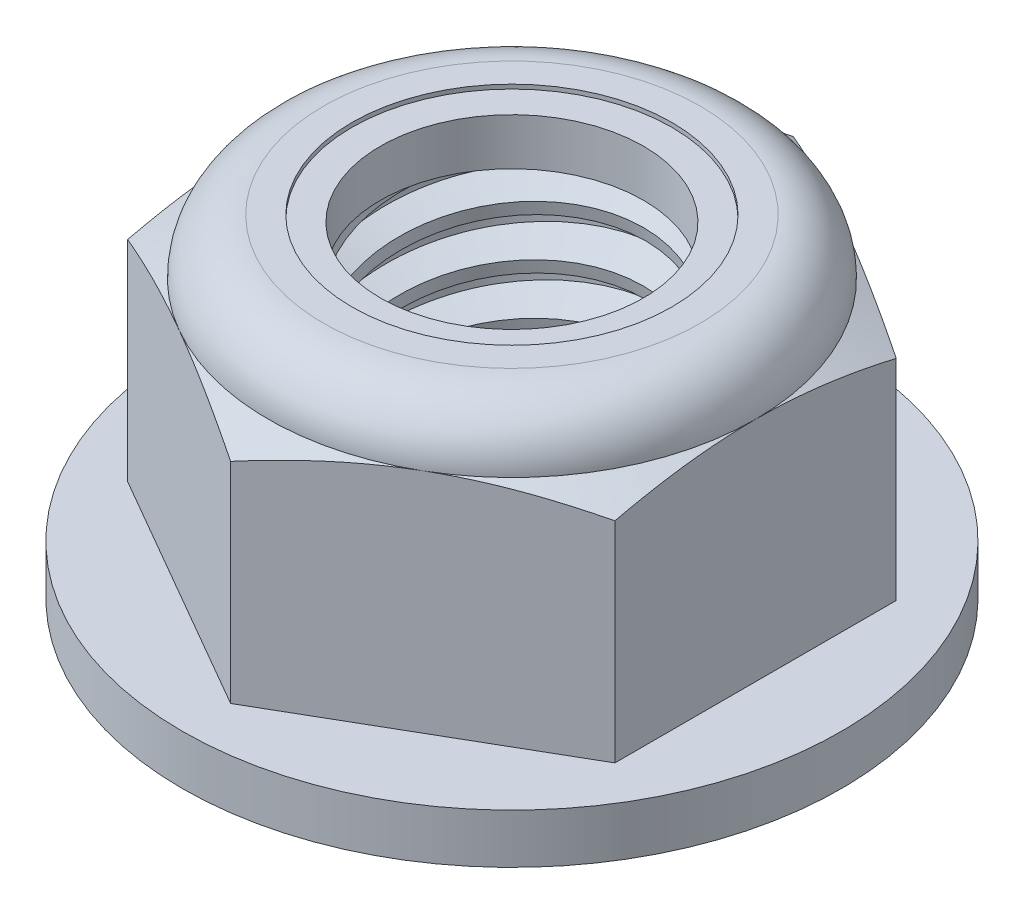
from build123d import *

# Parameters (mm, degrees)
EXTRUDE1_DEPTH       = 11.90625
SKETCH8_W            = 11.811
SKETCH8_H            = 1.778
SKETCH2_W            = 5.55625
SKETCH2_H            = 11.90625
LPATTERN1_COUNT      = 7
LPATTERN1_PITCH      = 1.814285714
LPATTERN1_COUNT_DIR2 = 2
LPATTERN1_PITCH_DIR2 = 1.814285714


with BuildPart() as part:
    # Sketch1 → Extrude1 (new body)
    with BuildSketch(Plane(origin=(0, 0, 0), x_dir=(1, 0, 0), z_dir=(0, 1, 0))):
        Polygon((0, 10.081979076), (-8.73125, 5.040989538), (-8.73125, -5.040989538), (0, -10.081979076), (8.73125, -5.040989538), (8.73125, 5.040989538), align=None)
    extrude(amount=EXTRUDE1_DEPTH)

    # Sketch8 → Revolve3 (revolve)
    with BuildSketch(Plane(origin=(0, 0, 0), x_dir=(0, 0, -1), z_dir=(1, 0, 0)), mode=Mode.PRIVATE) as revolve3_sk:
        with Locations((5.9055, 0.889)):
            Rectangle(SKETCH8_W, SKETCH8_H)
    revolve(revolve3_sk.sketch.rotate(Axis((0, 0, 0), (0, -1, 0)), 311.359571769), axis=Axis((0, 0, 0), (0, -1, 0)))

    # Sketch4 → Cut-Revolve2 (revolve, cut)
    with BuildSketch(Plane(origin=(0, 0, 0), x_dir=(0, 0, -1), z_dir=(1, 0, 0))):
        Polygon((0, 11.90625), (5.55625, 11.90625), (4.71496955, 11.513954483), (4.71496955, 0.392295517), (5.55625, 0), (0, 0), align=None)
    revolve(axis=Axis((0, 11.90625, 0), (0, 1, 0)), mode=Mode.SUBTRACT)


with BuildPart() as body_2:
    # Sketch2 → Revolve1 (revolve)
    with BuildSketch(Plane(origin=(0, 0, 0), x_dir=(0, 0, -1), z_dir=(1, 0, 0)), mode=Mode.PRIVATE) as revolve1_sk:
        with Locations((2.778125, 5.953125)):
            Rectangle(SKETCH2_W, SKETCH2_H)
    revolve(revolve1_sk.sketch.rotate(Axis((0, -5.55625, 0), (0, 1, 0)), 48.640428231), axis=Axis((0, -5.55625, 0), (0, 1, 0)))

    # Sketch3 → Cut-Revolve1 (revolve, cut)
    with BuildSketch(Plane(origin=(0, 0, 0), x_dir=(0, 0, -1), z_dir=(1, 0, 0))):
        Polygon((5.592792413, 11.682427722), (5.848589302, 10.115671773), (4.788054376, 10.51699418), (4.71496955, 10.964638737), align=None)
    cut_revolve1 = revolve(axis=Axis((0, 11.90625, 0.316929077), (0, -0.9869328807756821, -0.16113189890215235)), mode=Mode.SUBTRACT)

    # LPattern1: Cut-Revolve1 7 × 2
    with Locations(*[Vector(0, -1, 0) * (i * LPATTERN1_PITCH) + Vector(0, 1, 0) * (j * LPATTERN1_PITCH_DIR2) for i in range(LPATTERN1_COUNT) for j in range(LPATTERN1_COUNT_DIR2) if (i, j) != (0, 0)]):
        add(cut_revolve1, mode=Mode.SUBTRACT)


with BuildPart() as part_1:
    add(part.part)

    # Combine1: cut body 2
    add(body_2.part, mode=Mode.SUBTRACT)

    # Sketch5 → Cut-Revolve3 (revolve, cut)
    with BuildSketch(Plane(origin=(0, 0, 0), x_dir=(0, 0, -1), z_dir=(1, 0, 0))):
        with BuildLine():
            Line((10.081979076, 1.778), (10.081979076, 9.292019688))
            Line((10.081979076, 9.292019688), (8.73125, 9.921875))
            ThreePointArc((8.73125, 9.921875), (8.150040019, 11.325040019), (6.746875, 11.90625))
            Line((6.746875, 11.90625), (6.746875, 13.17625))
            Line((6.746875, 13.17625), (11.351979076, 13.17625))
            Line((11.351979076, 13.17625), (11.351979076, 1.778))
            Line((11.351979076, 1.778), (10.081979076, 1.778))
        make_face()
    revolve(axis=Axis((0, 0, 0), (0, 1, 0)), mode=Mode.SUBTRACT)

    # Sketch6 → Cut-Revolve4 (revolve, cut)
    with BuildSketch(Plane(origin=(0, 0, 0), x_dir=(0, 0, -1), z_dir=(1, 0, 0)), mode=Mode.PRIVATE) as cut_revolve4_sk:
        with BuildLine():
            Line((0, 9.921875), (8.57885, 9.921875))
            ThreePointArc((8.57885, 9.921875), (8.042276945, 11.217276945), (6.746875, 11.75385))
            Line((6.746875, 11.75385), (5.730922275, 11.75385))
            Line((5.730922275, 11.75385), (5.730922275, 13.17625))
            Line((5.730922275, 13.17625), (0, 13.17625))
            Line((0, 13.17625), (0, 9.921875))
        make_face()
    revolve(cut_revolve4_sk.sketch.rotate(Axis((0, 13.17625, 0), (0, 1, 0)), 55.123676687), axis=Axis((0, 13.17625, 0), (0, 1, 0)), mode=Mode.SUBTRACT)


with BuildPart() as body_2_2:
    # Sketch7 → Revolve2 (revolve)
    with BuildSketch(Plane(origin=(0, 0, 0), x_dir=(0, 0, -1), z_dir=(1, 0, 0)), mode=Mode.PRIVATE) as revolve2_sk:
        with BuildLine():
            Line((4.71496955, 9.998075), (8.500995694, 9.998075))
            ThreePointArc((8.500995694, 9.998075), (7.961155815, 11.190050048), (6.746875, 11.67765))
            Line((6.746875, 11.67765), (4.71496955, 11.67765))
            Line((4.71496955, 11.67765), (4.71496955, 9.998075))
        make_face()
    revolve(revolve2_sk.sketch.rotate(Axis((0, 9.998075, 0), (0, 1, 0)), 55.123676687), axis=Axis((0, 9.998075, 0), (0, 1, 0)))


solid = Compound([part_1.part, body_2_2.part])
